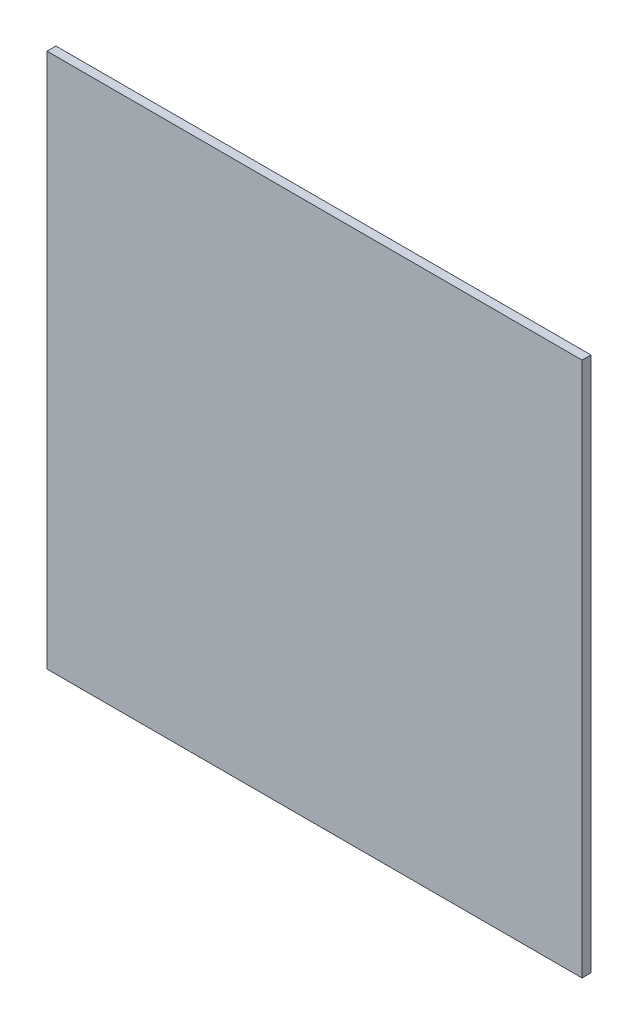
from build123d import *

# Parameters (mm, degrees)
SKETCH1_W           = 360
SKETCH1_H           = 360
BOSS_EXTRUDE1_DEPTH = 6
SKETCH2_W           = 200
SKETCH2_H           = 19
BOSS_EXTRUDE2_DEPTH = 70
BOSS_EXTRUDE3_DEPTH = 19


with BuildPart() as part:
    # Sketch1 → Boss-Extrude1 (new body)
    with BuildSketch(Plane.XY):
        Rectangle(SKETCH1_W, SKETCH1_H)
    extrude(amount=BOSS_EXTRUDE1_DEPTH)

    # Sketch2 → Boss-Extrude2 (add)
    with BuildSketch(Plane.XY):
        with Locations((0, -140.5)):
            Rectangle(SKETCH2_W, SKETCH2_H)
    extrude(amount=-BOSS_EXTRUDE2_DEPTH)

    # Sketch3 → Boss-Extrude3 (add)
    with BuildSketch(Plane(origin=(100, 0, 0), x_dir=(0, 0, -1), z_dir=(1, 0, 0))):
        Polygon((0, -131), (0, 86.467943448), (70, -11), (70, -131), align=None)
    boss_extrude3 = extrude(amount=-BOSS_EXTRUDE3_DEPTH)

    # Mirror1: Boss-Extrude3 across plane
    add(boss_extrude3.mirror(Plane(origin=(0, 0, 0), x_dir=(0, 0, 1), z_dir=(1, 0, 0))))


solid = part.part
